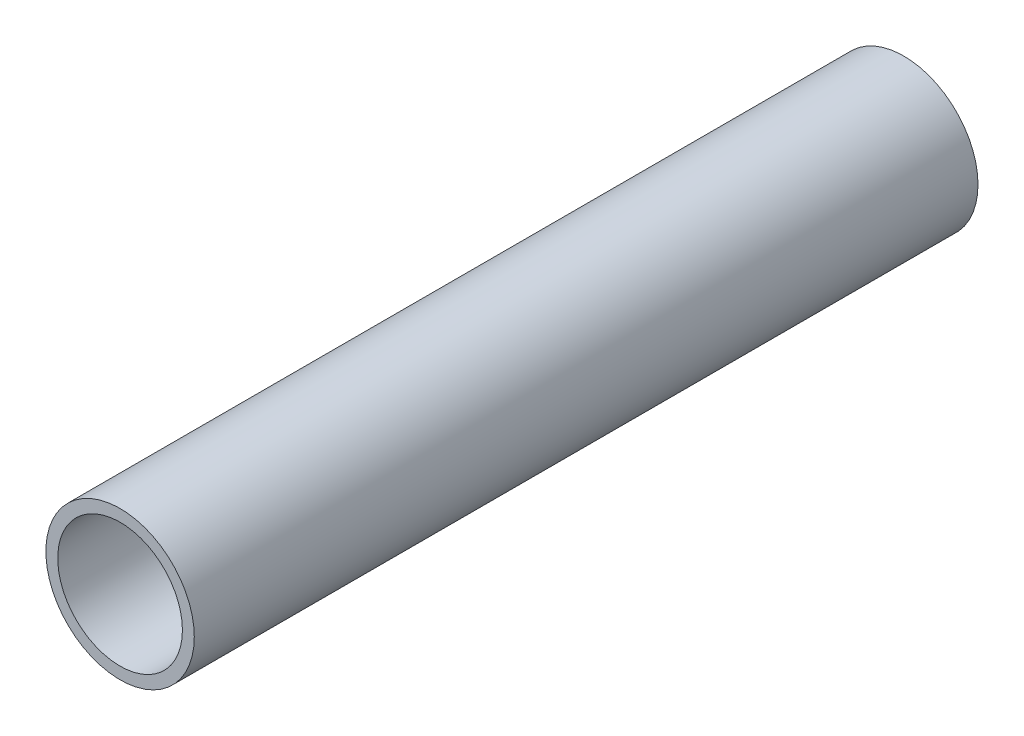
from build123d import *

# Parameters (mm, degrees)
CROQUIS1_R              = 12.5
CROQUIS1_R_2            = 10.5
SALIENTE_EXTRUIR1_DEPTH = 132


with BuildPart() as part:
    # Croquis1 → Saliente-Extruir1 (new body)
    with BuildSketch(Plane.XY):
        Circle(CROQUIS1_R)
        Circle(CROQUIS1_R_2, mode=Mode.SUBTRACT)
    extrude(amount=SALIENTE_EXTRUIR1_DEPTH)


solid = part.part
